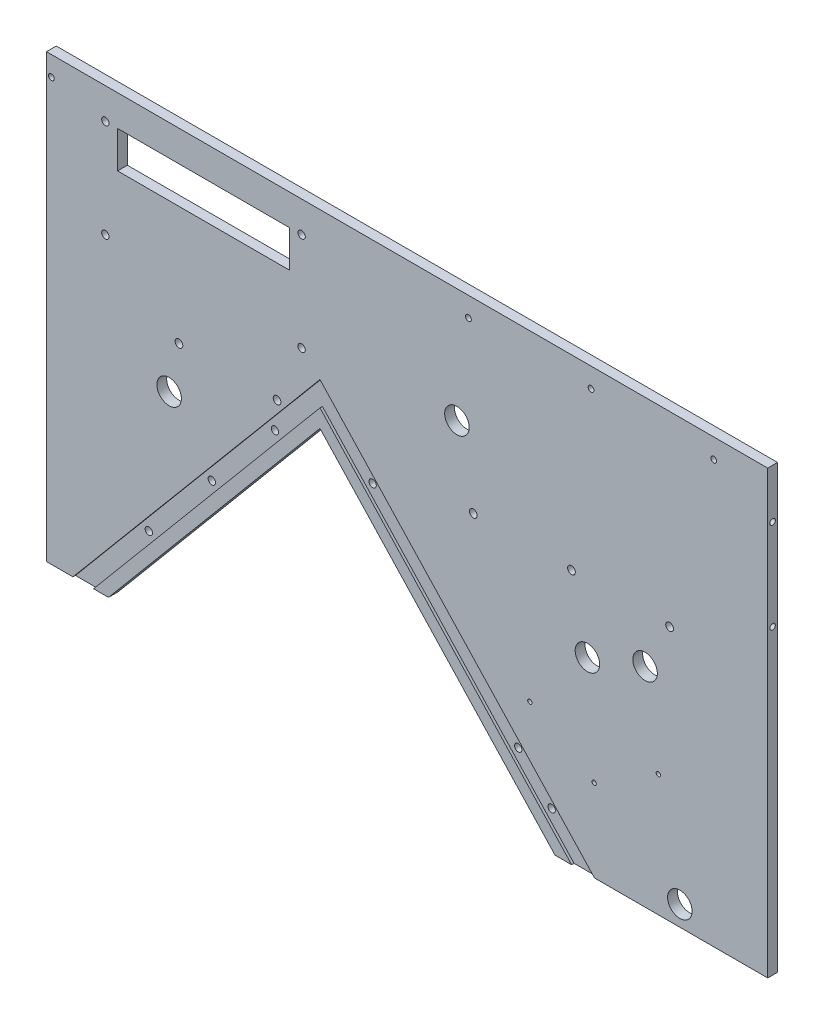
from build123d import *

# Parameters (mm, degrees)
BOSS_EXTRUDE1_DEPTH = 5.08
CUT_EXTRUDE1_DEPTH  = 1.27
SKETCH4_R           = 1.905
CUT_EXTRUDE2_DEPTH  = 7.62
SKETCH5_R           = 1.905
SKETCH5_W           = 88.9
SKETCH5_H           = 19.05
CUT_EXTRUDE3_DEPTH  = 7.62
SKETCH7_R           = 6.35
CUT_EXTRUDE5_DEPTH  = 7.62
SKETCH8_R           = 1.5
CUT_EXTRUDE6_DEPTH  = 25.4
SKETCH9_R           = 2
CUT_EXTRUDE7_DEPTH  = 381
SKETCH10_R          = 1.4224
CUT_EXTRUDE8_DEPTH  = 12.7
SKETCH6_R           = 6.35
CUT_EXTRUDE9_DEPTH  = 5.08
SKETCH11_R          = 1.1303
CUT_EXTRUDE10_DEPTH = 438.831463922


with BuildPart() as part:
    # Sketch2 → Boss-Extrude1 (new body)
    with BuildSketch(Plane.XY):
        Polygon((0, 0), (32.101676515, 0), (141.594783791, 130.488803961), (263.277562057, 0), (373.38, 0), (373.38, 228.6), (0, 228.6), align=None)
    extrude(amount=BOSS_EXTRUDE1_DEPTH)

    # Sketch3 → Cut-Extrude1 (cut)
    with BuildSketch(Plane.XY.offset(5.08)):
        Polygon((13.716, 0), (24.372565316, 0), (141.594783791, 139.7), (271.867141325, 0), (283.710082919, 0), (141.594783791, 152.4), align=None)
    extrude(amount=-CUT_EXTRUDE1_DEPTH, mode=Mode.SUBTRACT)

    # Sketch4 → Cut-Extrude2 (cut)
    with BuildSketch(Plane.XY.offset(3.81)):
        with Locations((51.69789323, 38.91505771)):
            Circle(SKETCH4_R)
        with Locations((84.351503802, 77.830115421)):
            Circle(SKETCH4_R)
        with Locations((117.005114374, 116.745173131)):
            Circle(SKETCH4_R)
        with Locations((167.57892131, 118.185423968)):
            Circle(SKETCH4_R)
        with Locations((242.932920113, 37.378153476)):
            Circle(SKETCH4_R)
        with Locations((260.255678459, 18.801769455)):
            Circle(SKETCH4_R)
    extrude(amount=-CUT_EXTRUDE2_DEPTH, mode=Mode.SUBTRACT)

    # Sketch5 → Cut-Extrude3 (cut)
    with BuildSketch(Plane.XY.offset(5.08)):
        with Locations((30.48, 212.598)):
            Circle(SKETCH5_R)
        with Locations((132.08, 212.598)):
            Circle(SKETCH5_R)
        with Locations((30.48, 161.798)):
            Circle(SKETCH5_R)
        with Locations((132.08, 161.798)):
            Circle(SKETCH5_R)
        with Locations((81.28, 203.073)):
            Rectangle(SKETCH5_W, SKETCH5_H)
    extrude(amount=-CUT_EXTRUDE3_DEPTH, mode=Mode.SUBTRACT)

    # Sketch7 → Cut-Extrude5 (cut)
    with BuildSketch(Plane.XY.offset(5.08)):
        with Locations((309.88, 107.95)):
            Circle(SKETCH7_R)
        with Locations((63.5, 107.95)):
            Circle(SKETCH7_R)
    extrude(amount=-CUT_EXTRUDE5_DEPTH, mode=Mode.SUBTRACT)

    # Sketch8 → Cut-Extrude6 (cut)
    with BuildSketch(Plane.XY.offset(5.08)):
        with Locations((2.54, 218.44)):
            Circle(SKETCH8_R)
        with Locations((218.44, 218.44)):
            Circle(SKETCH8_R)
        with Locations((281.94, 218.44)):
            Circle(SKETCH8_R)
        with Locations((345.44, 218.44)):
            Circle(SKETCH8_R)
    extrude(amount=-CUT_EXTRUDE6_DEPTH, mode=Mode.SUBTRACT)

    # Sketch9 → Cut-Extrude7 (cut)
    with BuildSketch(Plane.XY.offset(5.08)):
        with Locations((322.58, 132.08)):
            Circle(SKETCH9_R)
        with Locations((271.78, 132.08)):
            Circle(SKETCH9_R)
        with Locations((220.98, 132.08)):
            Circle(SKETCH9_R)
        with Locations((119.38, 132.08)):
            Circle(SKETCH9_R)
        with Locations((68.58, 132.08)):
            Circle(SKETCH9_R)
    extrude(amount=-CUT_EXTRUDE7_DEPTH, mode=Mode.SUBTRACT)

    # Sketch10 → Cut-Extrude8 (cut)
    with BuildSketch(Plane(origin=(373.38, 0, 0), x_dir=(0, 0, -1), z_dir=(1, 0, 0))):
        with Locations((-2.54, 203.2)):
            Circle(SKETCH10_R)
        with Locations((-2.54, 156.21)):
            Circle(SKETCH10_R)
    extrude(amount=-CUT_EXTRUDE8_DEPTH, mode=Mode.SUBTRACT)

    # Sketch6 → Cut-Extrude9 (cut)
    with BuildSketch(Plane.XY.offset(5.08)):
        with Locations((212.494293851, 169.478312144)):
            Circle(SKETCH6_R)
        with Locations((280.053051399, 97.030414462)):
            Circle(SKETCH6_R)
        with Locations((327.886055199, 10.284305918)):
            Circle(SKETCH6_R)
    extrude(amount=-CUT_EXTRUDE9_DEPTH, mode=Mode.SUBTRACT)

    # Sketch11 → Cut-Extrude10 (cut, through all)
    with BuildSketch(Plane(origin=(0, 0, 0), x_dir=(-1, 0, 0), z_dir=(0, 0, -1))):
        with Locations((-316.75973092, 63.088723784)):
            Circle(SKETCH11_R)
        with Locations((-250.246994693, 62.340329973)):
            Circle(SKETCH11_R)
        with Locations((-283.511442727, 42.644318593)):
            Circle(SKETCH11_R)
    extrude(amount=-CUT_EXTRUDE10_DEPTH, mode=Mode.SUBTRACT)


solid = part.part
